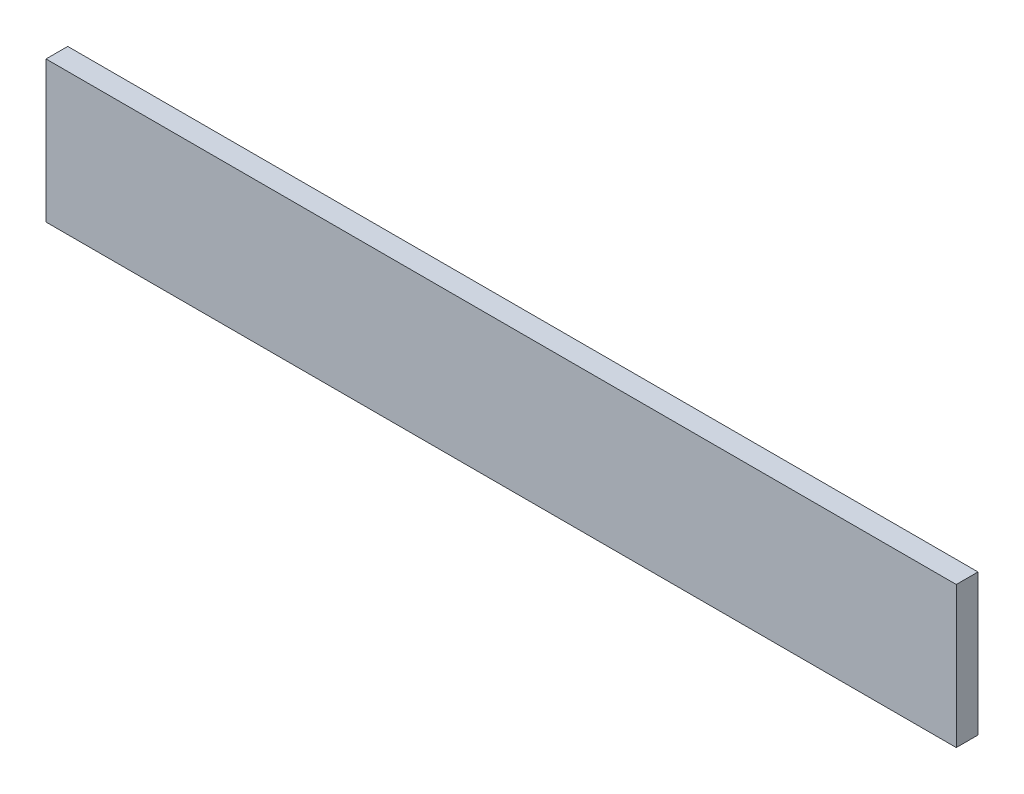
from build123d import *

# Parameters (mm, degrees)
ESQUISSE1_W        = 531.9161066
ESQUISSE1_H        = 82.55
BOSS_EXTRU_1_DEPTH = 12.7


with BuildPart() as part:
    # Esquisse1 → Boss.-Extru.1 (new body)
    with BuildSketch(Plane.XY):
        Rectangle(ESQUISSE1_W, ESQUISSE1_H)
    extrude(amount=BOSS_EXTRU_1_DEPTH)


solid = part.part
